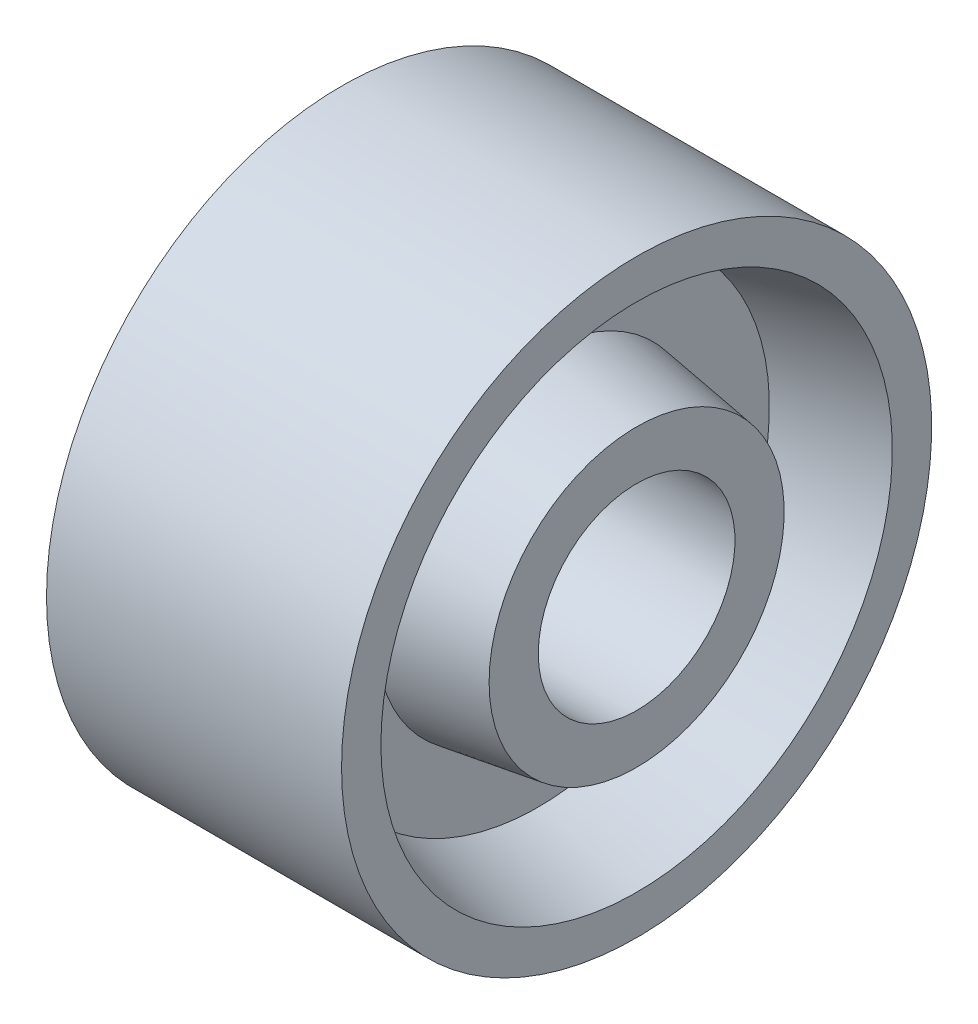
from build123d import *


with BuildPart() as part:
    # Sketch1 → Revolve1 (revolve)
    with BuildSketch(Plane.XY, mode=Mode.PRIVATE) as revolve1_sk:
        Polygon((0, 10), (30, 10), (30, 15), (20, 16.5), (20, 23.5), (30, 26), (30, 30), (0, 30), (0, 26), (10, 23.5), (10, 16.5), (0, 15), align=None)
    revolve(revolve1_sk.sketch.rotate(Axis((0, 0, 0), (1, 0, 0)), 90), axis=Axis((0, 0, 0), (1, 0, 0)))


solid = part.part
